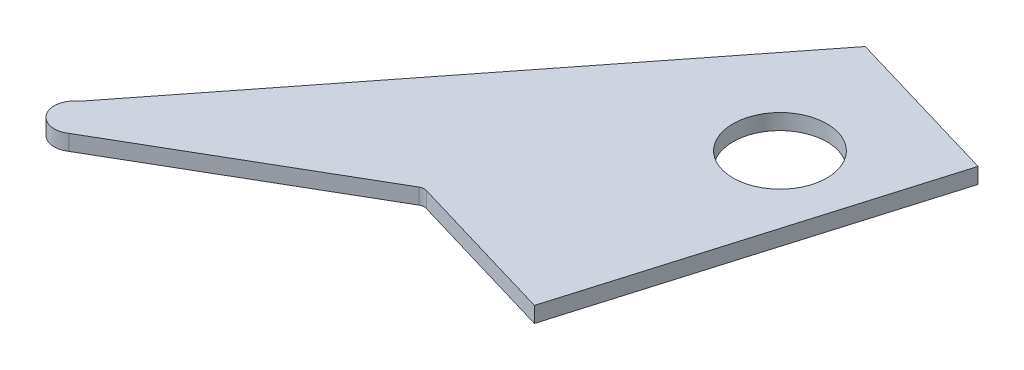
from build123d import *

# Parameters (mm, degrees)
BOSS_EXTRUDE1_DEPTH = 4.7625
SKETCH2_R           = 14.2875
CUT_EXTRUDE1_DEPTH  = 127.195863524


with BuildPart() as part:
    # Sketch1 → Boss-Extrude1 (new body)
    with BuildSketch(Plane(origin=(0, 0, 0), x_dir=(1, 0, 0), z_dir=(0, 1, 0))):
        with BuildLine():
            Line((53.854446853, 73.373362576), (102.562489384, 58.945383065))
            Line((102.562489384, 58.945383065), (71.73313232, -45.132782137))
            Line((71.73313232, -45.132782137), (24.990181224, -31.286889228))
            ThreePointArc((24.990181224, -31.286889228), (23.967852385, -31.200180886), (22.994624733, -31.524992416))
            Line((22.994624733, -31.524992416), (-44.326137807, -70.562582621))
            ThreePointArc((-44.326137807, -70.562582621), (-52.787800823, -69.037356261), (-51.262574464, -60.575693244))
            Line((-51.262574464, -60.575693244), (53.854446853, 73.373362576))
        make_face()
    extrude(amount=BOSS_EXTRUDE1_DEPTH)

    # Sketch2 → Cut-Extrude1 (cut, through all)
    with BuildSketch(Plane(origin=(0, 4.7625, 0), x_dir=(1, 0, 0), z_dir=(0, 1, 0))):
        with Locations(Location((68.361372102, 32.916133793, 0), (0, 0, 270))):
            Circle(SKETCH2_R)
    extrude(amount=-CUT_EXTRUDE1_DEPTH, mode=Mode.SUBTRACT)


solid = part.part
